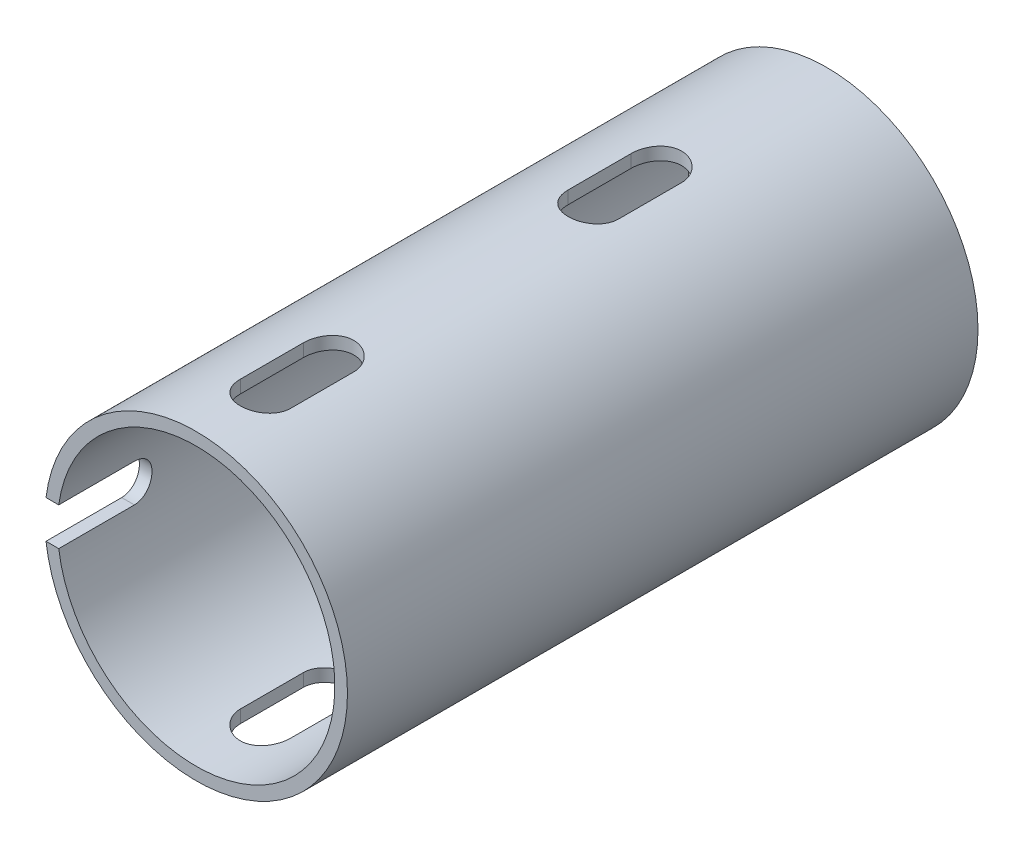
from build123d import *

# Parameters (mm, degrees)
SKETCH_1_R          = 24
SKETCH_1_R_2        = 22
EXTRUDE_1_DEPTH     = 50
CUT_EXTRUDE_1_DEPTH = 20
CUT_EXTRUDE_2_DEPTH = 74.34848345


with BuildPart() as part:
    # 草图1 → 凸台-拉伸1 (new, symmetric)
    with BuildSketch(Plane.XY):
        Circle(SKETCH_1_R)
        Circle(SKETCH_1_R_2, mode=Mode.SUBTRACT)
    extrude(amount=EXTRUDE_1_DEPTH, both=True)

    # 草图2 → 切除-拉伸1 (cut)
    with BuildSketch(Plane.ZY.offset(24)):
        with BuildLine():
            Line((38, 3), (50, 3))
            Line((50, 3), (50, -3))
            Line((50, -3), (38, -3))
            ThreePointArc((38, -3), (35, 0), (38, 3))
        make_face()
    extrude(amount=-CUT_EXTRUDE_1_DEPTH, mode=Mode.SUBTRACT)

    # 草图3 → 切除-拉伸2 (cut, through all)
    with BuildSketch(Plane(origin=(0, 24, 0), x_dir=(1, 0, 0), z_dir=(0, 1, 0))):
        with BuildLine():
            Line((-4, 13), (-4, 23))
            ThreePointArc((-4, 23), (0, 27), (4, 23))
            Line((4, 23), (4, 13))
            ThreePointArc((4, 13), (0, 9), (-4, 13))
        make_face()
        with BuildLine():
            Line((-4, -39), (-4, -29))
            ThreePointArc((-4, -29), (0, -25), (4, -29))
            Line((4, -29), (4, -39))
            ThreePointArc((4, -39), (0, -43), (-4, -39))
        make_face()
    extrude(amount=-CUT_EXTRUDE_2_DEPTH, mode=Mode.SUBTRACT)


solid = part.part
